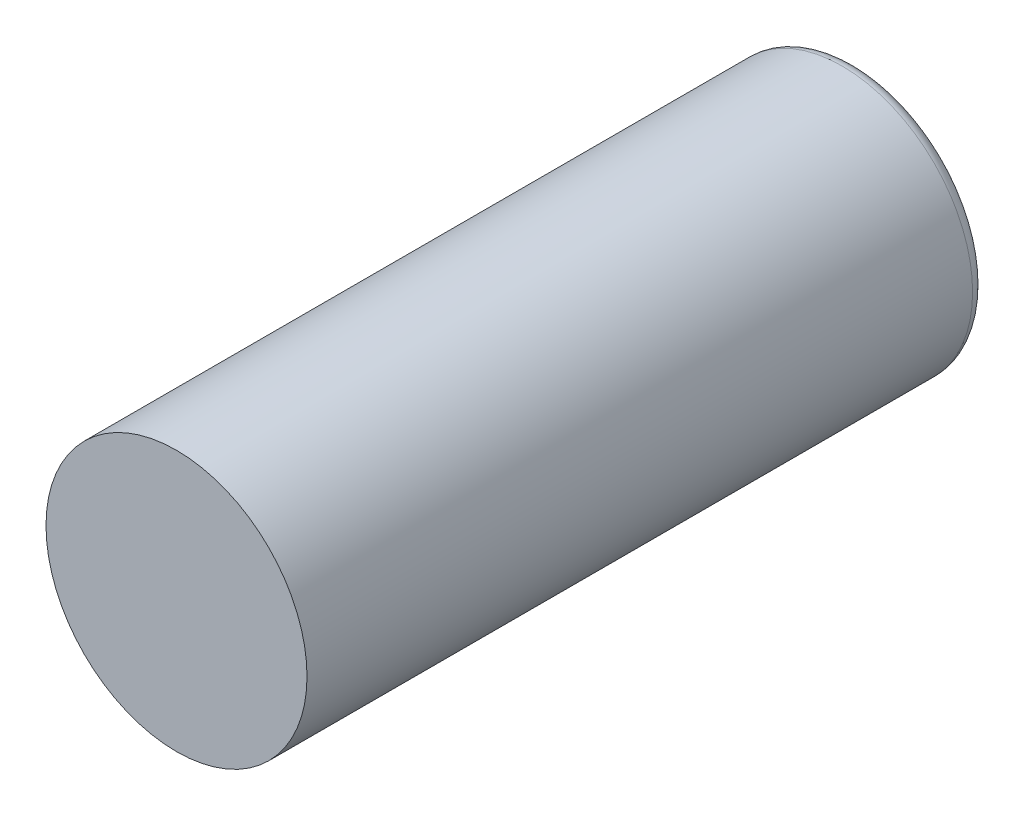
from build123d import *

# Parameters (mm, degrees)
SKETCH2_R           = 2.5
BOSS_EXTRUDE1_DEPTH = 13
FILLET1_R           = 0.25


with BuildPart() as part:
    # Sketch2 → Boss-Extrude1 (new body)
    with BuildSketch(Plane.XY):
        with Locations(Location((0, 0, 0), (0, 0, 180))):
            Circle(SKETCH2_R)
    extrude(amount=BOSS_EXTRUDE1_DEPTH)

    # Fillet1
    fillet1_edges = [part.edges().sort_by_distance(p)[0] for p in [
        (2.5, 0, 0),
    ]]
    fillet(fillet1_edges, radius=FILLET1_R)


solid = part.part
